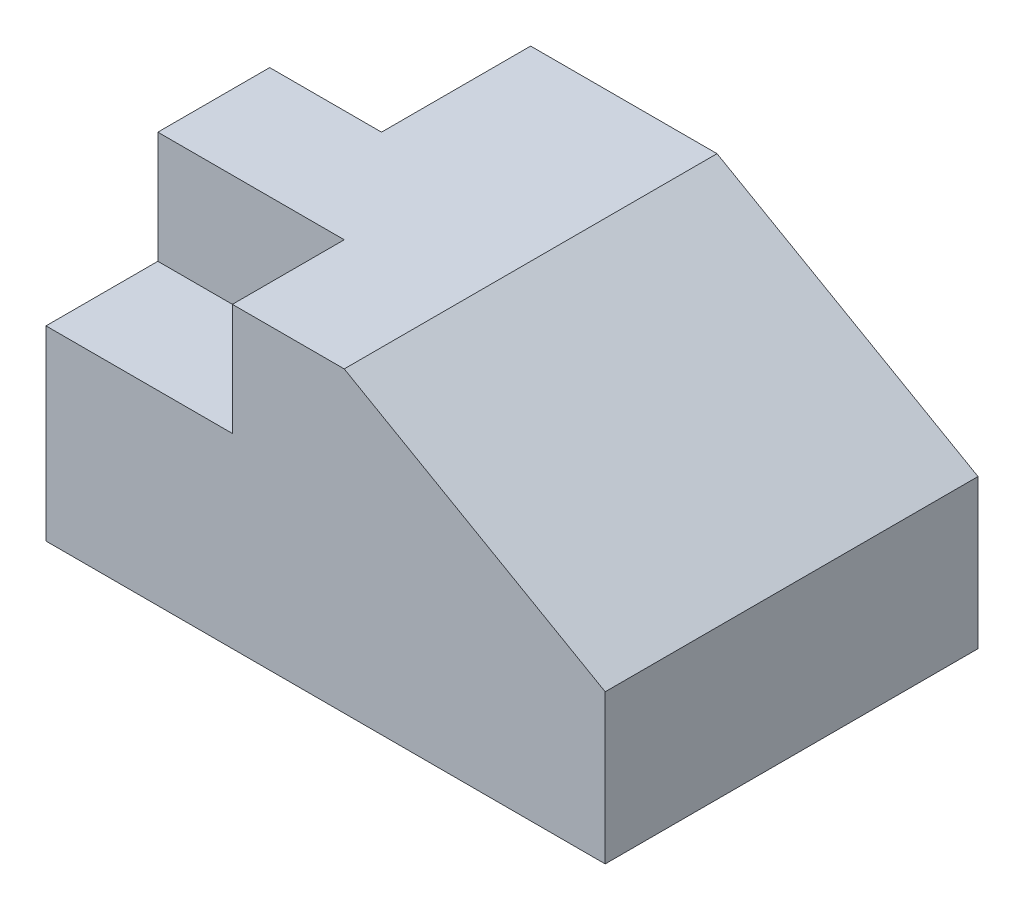
from build123d import *

# Parameters (mm, degrees)
BOSS_EXTRUDE4_DEPTH = 100
SKETCH13_W          = 50
SKETCH13_H          = 30
CUT_EXTRUDE2_DEPTH  = 30
SKETCH14_W          = 30
SKETCH14_H          = 40
CUT_EXTRUDE3_DEPTH  = 198.230829233


with BuildPart() as part:
    # Sketch5 → Boss-Extrude4 (new body)
    with BuildSketch(Plane.XY):
        Polygon((0, 0), (150, 0), (150, 40), (80, 80), (0, 80), align=None)
    extrude(amount=-BOSS_EXTRUDE4_DEPTH)

    # Sketch13 → Cut-Extrude2 (cut)
    with BuildSketch(Plane.XY):
        with Locations((25, 65)):
            Rectangle(SKETCH13_W, SKETCH13_H)
    extrude(amount=-CUT_EXTRUDE2_DEPTH, mode=Mode.SUBTRACT)

    # Sketch14 → Cut-Extrude3 (cut, through all)
    with BuildSketch(Plane(origin=(0, 80, 0), x_dir=(1, 0, 0), z_dir=(0, 1, 0))):
        with Locations((15, 80)):
            Rectangle(SKETCH14_W, SKETCH14_H)
    extrude(amount=-CUT_EXTRUDE3_DEPTH, mode=Mode.SUBTRACT)


solid = part.part
